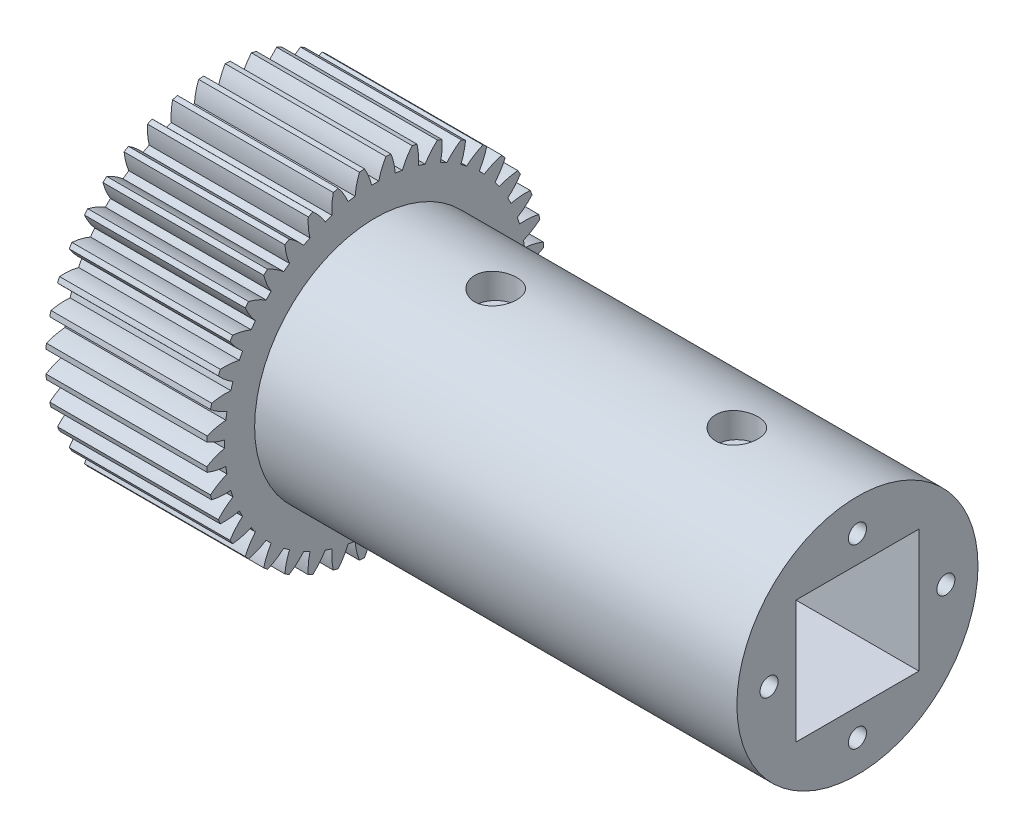
from build123d import *

# Parameters (mm, degrees)
BASPROSKE_W             = 40
BASPROSKE_H             = 42
TOOTHCUT_DEPTH          = 72.61005516
TEETHCUTS_COUNT         = 40
TEETHCUTS_ANGLE         = 351
BORSKE_R                = 0.4
BORE_DEPTH              = 50.0000508
SKETCH1_W               = 30.6
SKETCH1_H               = 30.6
CUT_EXTRUDE1_DEPTH      = 72.510885263
SKETCH2_R               = 30
SKETCH2_W               = 30.6
SKETCH2_H               = 30.6
BOSS_EXTRUDE1_DEPTH     = 120
SKETCH3_R               = 2.25
CUT_EXTRUDE2_DEPTH      = 10
CUT_EXTRUDE3_DEPTH      = 171.62768448
CUT_EXTRUDE3_DEPTH_BACK = 171.62768448
SKETCH4_R               = 3.2
CUT_EXTRUDE4_DEPTH      = 10
SKETCH7_R               = 5.25
CUT_EXTRUDE5_DEPTH      = 6.5


with BuildPart() as part:
    # BasProSke → Base-Revolve (revolve)
    with BuildSketch(Plane(origin=(0, 0, 0), x_dir=(1, 0, 0), z_dir=(0, 1, 0)), mode=Mode.PRIVATE) as base_revolve_sk:
        with Locations((20, 21)):
            Rectangle(BASPROSKE_W, BASPROSKE_H)
    revolve(base_revolve_sk.sketch.rotate(Axis((-10, 0, 0), (1, 0, 0)), 180), axis=Axis((-10, 0, 0), (1, 0, 0)))

    # TooCutSke → ToothCut (cut, through all)
    with BuildSketch(Plane(origin=(0, 0, 0), x_dir=(0, 0, -1), z_dir=(1, 0, 0))):
        with BuildLine():
            ThreePointArc((0.882812088, 37.488606854), (0, 37.499), (-0.882812088, 37.488606854))
            ThreePointArc((-0.882812088, 37.488606854), (-1.612748684, 39.782000434), (-2.678427154, 41.939960338))
            ThreePointArc((-2.678427154, 41.939960338), (0, 42.0254), (2.678427154, 41.939960338))
            ThreePointArc((2.678427154, 41.939960338), (1.612748684, 39.782000434), (0.882812088, 37.488606854))
        make_face()
    toothcut = extrude(amount=TOOTHCUT_DEPTH, mode=Mode.SUBTRACT)

    # TeethCuts: ToothCut ×40 about axis
    teethcuts_axis = Axis((-10, 0, 0), (1, 0, 0))
    for i in range(1, TEETHCUTS_COUNT):
        add(toothcut.rotate(teethcuts_axis, i * TEETHCUTS_ANGLE / (TEETHCUTS_COUNT - 1)), mode=Mode.SUBTRACT)

    # BorSke → Bore (cut, symmetric)
    with BuildSketch(Plane(origin=(0, 0, 0), x_dir=(0, 0, -1), z_dir=(1, 0, 0))):
        with Locations(Location((0, 0, 0), (0, 0, 180))):
            Circle(BORSKE_R)
    extrude(amount=BORE_DEPTH, both=True, mode=Mode.SUBTRACT)

    # Sketch1 → Cut-Extrude1 (cut, through all)
    with BuildSketch(Plane(origin=(40, 0, 0), x_dir=(0, 0, -1), z_dir=(1, 0, 0))):
        Rectangle(SKETCH1_W, SKETCH1_H)
    extrude(amount=-CUT_EXTRUDE1_DEPTH, mode=Mode.SUBTRACT)

    # Sketch2 → Boss-Extrude1 (add)
    with BuildSketch(Plane(origin=(40, 0, 0), x_dir=(0, 0, -1), z_dir=(1, 0, 0))):
        with Locations(Location((0, 0, 0), (0, 0, 180))):
            Circle(SKETCH2_R)
        Rectangle(SKETCH2_W, SKETCH2_H, mode=Mode.SUBTRACT)
    extrude(amount=BOSS_EXTRUDE1_DEPTH)

    # Sketch3 → Cut-Extrude2 (cut)
    with BuildSketch(Plane(origin=(160, 0, 0), x_dir=(0, 0, -1), z_dir=(1, 0, 0))):
        with Locations((22, 0)):
            Circle(SKETCH3_R)
        with Locations((0, -22)):
            Circle(SKETCH3_R)
        with Locations((-22, 0)):
            Circle(SKETCH3_R)
        with Locations((0, 22)):
            Circle(SKETCH3_R)
    extrude(amount=-CUT_EXTRUDE2_DEPTH, mode=Mode.SUBTRACT)

    # Sketch4 → Cut-Extrude3 (cut, two sides: drawn at the far end of the back side and taken through both)
    with BuildSketch(Plane(origin=(0, 0, 0), x_dir=(1, 0, 0), z_dir=(0, 1, 0)).offset(-CUT_EXTRUDE3_DEPTH_BACK)):
        with Locations(Location((70, 0, 0), (0, 0, 270))):
            Circle(SKETCH4_R)
        with Locations(Location((130, 0, 0), (0, 0, 270))):
            Circle(SKETCH4_R)
    extrude(amount=CUT_EXTRUDE3_DEPTH + CUT_EXTRUDE3_DEPTH_BACK, mode=Mode.SUBTRACT)

    # Sketch6 → Cut-Extrude4 (cut)
    with BuildSketch(Plane(origin=(0, -30, 0), x_dir=(-1, 0, 0), z_dir=(0, -1, 0))):
        Polygon((-123.9955572, 0), (-126.9977786, 5.2), (-133.0022214, 5.2), (-136.0044428, 0), (-133.0022214, -5.2), (-126.9977786, -5.2), align=None)
        Polygon((-76.0044428, 0), (-73.0022214, -5.2), (-66.9977786, -5.2), (-63.9955572, 0), (-66.9977786, 5.2), (-73.0022214, 5.2), align=None)
    extrude(amount=-CUT_EXTRUDE4_DEPTH, mode=Mode.SUBTRACT)

    # Sketch7 → Cut-Extrude5 (cut)
    with BuildSketch(Plane(origin=(0, 30, 0), x_dir=(1, 0, 0), z_dir=(0, 1, 0))):
        with Locations(Location((70, 0, 0), (0, 0, 270))):
            Circle(SKETCH7_R)
        with Locations(Location((130, 0, 0), (0, 0, 270))):
            Circle(SKETCH7_R)
    extrude(amount=-CUT_EXTRUDE5_DEPTH, mode=Mode.SUBTRACT)


solid = part.part
